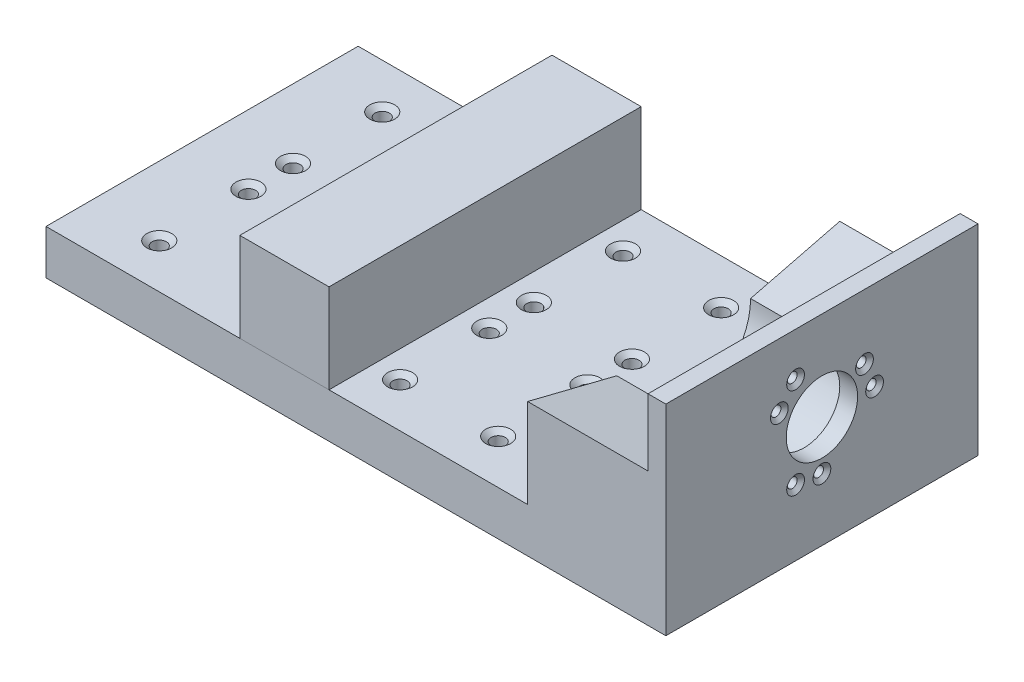
from build123d import *

# Parameters (mm, degrees)
SKETCH1_W                                         = 139.7
SKETCH1_H                                         = 88.9
BOSS_EXTRUDE1_DEPTH                               = 76.2
CUT_EXTRUDE1_DEPTH                                = 183.279291199
CUT_EXTRUDE1_DEPTH_BACK                           = 34.29
BOSS_EXTRUDE2_DEPTH                               = 5.08
BOSS_EXTRUDE3_START                               = -5.08
SKETCH5_R                                         = 10.16
BOSS_EXTRUDE3_DEPTH                               = 5.08
CUT_EXTRUDE2_DEPTH                                = 183.279291199
CUT_EXTRUDE2_DEPTH_BACK                           = 63.5
SKETCH6_W                                         = 105.41
SKETCH6_H                                         = 88.9
SKETCH7_W                                         = 88.9
SKETCH7_H                                         = 12.7
BOSS_EXTRUDE4_DEPTH                               = 31.75
CSK_FOR_6_FLAT_HEAD_MACHINE_SCREW_100_D           = 4.064
CSK_FOR_6_FLAT_HEAD_MACHINE_SCREW_100_CSINK_D     = 7.0866
CSK_FOR_6_FLAT_HEAD_MACHINE_SCREW_100_CSINK_ANGLE = 100
SKETCH10_W                                        = 25.4
SKETCH10_H                                        = 88.9
BOSS_EXTRUDE5_DEPTH                               = 25.4
CSK_FOR_3_FLAT_HEAD_MACHINE_SCREW_2_COUNT         = 2
CSK_FOR_3_FLAT_HEAD_MACHINE_SCREW_2_PITCH         = 7.567635122
CSK_FOR_3_FLAT_HEAD_MACHINE_SCREW_3_COUNT         = 2
CSK_FOR_3_FLAT_HEAD_MACHINE_SCREW_3_PITCH         = 20.518243492
CSK_FOR_3_FLAT_HEAD_MACHINE_SCREW_4_COUNT         = 2
CSK_FOR_3_FLAT_HEAD_MACHINE_SCREW_4_PITCH         = 28.012988607
CSK_FOR_3_FLAT_HEAD_MACHINE_SCREW_5_COUNT         = 2
CSK_FOR_3_FLAT_HEAD_MACHINE_SCREW_5_PITCH         = 25.980710152
CSK_FOR_3_FLAT_HEAD_MACHINE_SCREW_6_COUNT         = 2
CSK_FOR_3_FLAT_HEAD_MACHINE_SCREW_6_PITCH         = 25.980710152


with BuildPart() as part:
    # Sketch1 → Boss-Extrude1 (new body)
    with BuildSketch(Plane(origin=(0, 0, 0), x_dir=(1, 0, 0), z_dir=(0, 1, 0))):
        with Locations((-69.85, -44.45)):
            Rectangle(SKETCH1_W, SKETCH1_H)
    extrude(amount=BOSS_EXTRUDE1_DEPTH)

    # Sketch2 → Cut-Extrude1 (cut, two sides: drawn at the far end of the back side and taken through both)
    with BuildSketch(Plane(origin=(0, 0, 0), x_dir=(0, 0, -1), z_dir=(1, 0, 0)).offset(-CUT_EXTRUDE1_DEPTH_BACK)):
        with BuildLine():
            Line((-88.9, 38.1), (-63.5, 31.75))
            ThreePointArc((-63.5, 31.75), (-44.45, 12.7), (-25.4, 31.75))
            Line((-25.4, 31.75), (0, 38.1))
            Line((0, 38.1), (0, 76.2))
            Line((0, 76.2), (-88.9, 76.2))
            Line((-88.9, 76.2), (-88.9, 38.1))
        make_face()
    extrude(amount=CUT_EXTRUDE1_DEPTH + CUT_EXTRUDE1_DEPTH_BACK, mode=Mode.SUBTRACT)

    # Sketch4 → Boss-Extrude2 (add)
    with BuildSketch(Plane(origin=(0, 0, 0), x_dir=(0, 0, -1), z_dir=(1, 0, 0))):
        with BuildLine():
            Line((-88.9, 38.1), (-63.5, 31.75))
            ThreePointArc((-63.5, 31.75), (-44.45, 12.7), (-25.4, 31.75))
            Line((-25.4, 31.75), (0, 38.1))
            Line((0, 38.1), (0, 0))
            Line((0, 0), (-88.9, 0))
            Line((-88.9, 0), (-88.9, 38.1))
        make_face()
    extrude(amount=BOSS_EXTRUDE2_DEPTH)

    # Sketch5 → Boss-Extrude3 (add)
    # profile 1 of 2: a face of its own
    with BuildSketch(Plane(origin=(5.08, 0, 0), x_dir=(0, 0, -1), z_dir=(1, 0, 0)).offset(BOSS_EXTRUDE3_START)):
        with BuildLine():
            Line((0, 57.15), (-88.9, 57.15))
            Line((-88.9, 57.15), (-88.9, 38.1))
            Line((-88.9, 38.1), (-63.5, 31.75))
            ThreePointArc((-63.5, 31.75), (-44.45, 50.8), (-25.4, 31.75))
            Line((-25.4, 31.75), (0, 38.1))
            Line((0, 38.1), (0, 57.15))
        make_face()
    # profile 2 of 2: a face of its own
    with BuildSketch(Plane(origin=(5.08, 0, 0), x_dir=(0, 0, -1), z_dir=(1, 0, 0)).offset(BOSS_EXTRUDE3_START)):
        with BuildLine():
            ThreePointArc((-25.4, 31.75), (-44.45, 50.8), (-63.5, 31.75))
            ThreePointArc((-63.5, 31.75), (-44.45, 12.7), (-25.4, 31.75))
        make_face()
        with Locations((-44.45, 31.75)):
            Circle(SKETCH5_R, mode=Mode.SUBTRACT)
    extrude(amount=BOSS_EXTRUDE3_DEPTH)

    # Sketch6 → Cut-Extrude2 (cut, two sides: drawn at the far end of the back side and taken through both)
    with BuildSketch(Plane(origin=(0, 76.2, 0), x_dir=(1, 0, 0), z_dir=(0, 1, 0)).offset(-CUT_EXTRUDE2_DEPTH_BACK)):
        with Locations((-86.995, -44.45)):
            Rectangle(SKETCH6_W, SKETCH6_H)
    extrude(amount=CUT_EXTRUDE2_DEPTH + CUT_EXTRUDE2_DEPTH_BACK, mode=Mode.SUBTRACT)

    # Sketch7 → Boss-Extrude4 (add)
    with BuildSketch(Plane.ZY.offset(139.7)):
        with Locations((44.45, 6.35)):
            Rectangle(SKETCH7_W, SKETCH7_H)
    extrude(amount=BOSS_EXTRUDE4_DEPTH)

    # CSK for #6 Flat Head Machine Screw (100)1 (through all)
    with Locations(Plane(origin=(0, 12.7, 0), x_dir=(1, 0, 0), z_dir=(0, 1, 0))):
        with Locations((-55.274756895, -38.196590789), (-55.274756895, -12.796590789), (-123.854756895, -12.796590789), (-123.854756895, -50.896590789), (-151.794756895, -12.796590789), (-151.794756895, -38.196590789), (-123.854756895, -38.196590789), (-151.794756895, -50.896590789), (-151.794756895, -76.296590789), (-123.854756895, -76.296590789), (-55.274756895, -50.896590789), (-83.214756895, -12.796590789), (-83.214756895, -38.196590789), (-83.214756895, -50.896590789), (-83.214756895, -76.296590789), (-55.274756895, -76.296590789)):
            CounterSinkHole(CSK_FOR_6_FLAT_HEAD_MACHINE_SCREW_100_D / 2, CSK_FOR_6_FLAT_HEAD_MACHINE_SCREW_100_CSINK_D / 2, counter_sink_angle=CSK_FOR_6_FLAT_HEAD_MACHINE_SCREW_100_CSINK_ANGLE)

    # Sketch12 → CSK for #3 Flat Head Machine Screw (100)1 (revolve, cut)
    with BuildSketch(Plane(origin=(5.08, 18.759644924, 51.949985), x_dir=(0, 0, -1), z_dir=(0, 1, 0))):
        Polygon((0, 0), (0, 26.239402285), (1.397, 25.4), (1.397, 0.948434313), (2.5273, 0), align=None)
    csk_for_3_flat_head_machine_screw_100 = revolve(axis=Axis((11.43, 18.759644924, 51.949985), (-1, 0, 0)), mode=Mode.SUBTRACT)

    # CSK for _3 Flat Head Machine Screw _ 2: CSK for #3 Flat Head Machine Screw (100)1 ×2
    with Locations(*[Vector(0, -0.13341247401263837, -0.9910605994477972) * (i * CSK_FOR_3_FLAT_HEAD_MACHINE_SCREW_2_PITCH) for i in range(1, CSK_FOR_3_FLAT_HEAD_MACHINE_SCREW_2_COUNT)]):
        add(csk_for_3_flat_head_machine_screw_100, mode=Mode.SUBTRACT)

    # CSK for _3 Flat Head Machine Screw _ 3: CSK for #3 Flat Head Machine Screw (100)1 ×2
    with Locations(*[Vector(0, 0.9742715590487785, 0.225377304156081) * (i * CSK_FOR_3_FLAT_HEAD_MACHINE_SCREW_3_PITCH) for i in range(1, CSK_FOR_3_FLAT_HEAD_MACHINE_SCREW_3_COUNT)]):
        add(csk_for_3_flat_head_machine_screw_100, mode=Mode.SUBTRACT)

    # CSK for _3 Flat Head Machine Screw _ 4: CSK for #3 Flat Head Machine Screw (100)1 ×2
    with Locations(*[Vector(0, 0.7136097242883989, -0.7005434757393973) * (i * CSK_FOR_3_FLAT_HEAD_MACHINE_SCREW_4_PITCH) for i in range(1, CSK_FOR_3_FLAT_HEAD_MACHINE_SCREW_4_COUNT)]):
        add(csk_for_3_flat_head_machine_screw_100, mode=Mode.SUBTRACT)

    # CSK for _3 Flat Head Machine Screw _ 5: CSK for #3 Flat Head Machine Screw (100)1 ×2
    with Locations(*[(0, i * CSK_FOR_3_FLAT_HEAD_MACHINE_SCREW_5_PITCH, 0) for i in range(1, CSK_FOR_3_FLAT_HEAD_MACHINE_SCREW_5_COUNT)]):
        add(csk_for_3_flat_head_machine_screw_100, mode=Mode.SUBTRACT)

    # CSK for _3 Flat Head Machine Screw _ 6: CSK for #3 Flat Head Machine Screw (100)1 ×2
    with Locations(*[Vector(0, 0.49999999999999856, -0.8660254037844395) * (i * CSK_FOR_3_FLAT_HEAD_MACHINE_SCREW_6_PITCH) for i in range(1, CSK_FOR_3_FLAT_HEAD_MACHINE_SCREW_6_COUNT)]):
        add(csk_for_3_flat_head_machine_screw_100, mode=Mode.SUBTRACT)


with BuildPart() as body_2:
    # Sketch10 → Boss-Extrude5 (new body)
    with BuildSketch(Plane(origin=(0, 12.7, 0), x_dir=(1, 0, 0), z_dir=(0, 1, 0))):
        with Locations((-103.547456895, -44.45)):
            Rectangle(SKETCH10_W, SKETCH10_H)
    extrude(amount=BOSS_EXTRUDE5_DEPTH)


solid = Compound([part.part, body_2.part])
